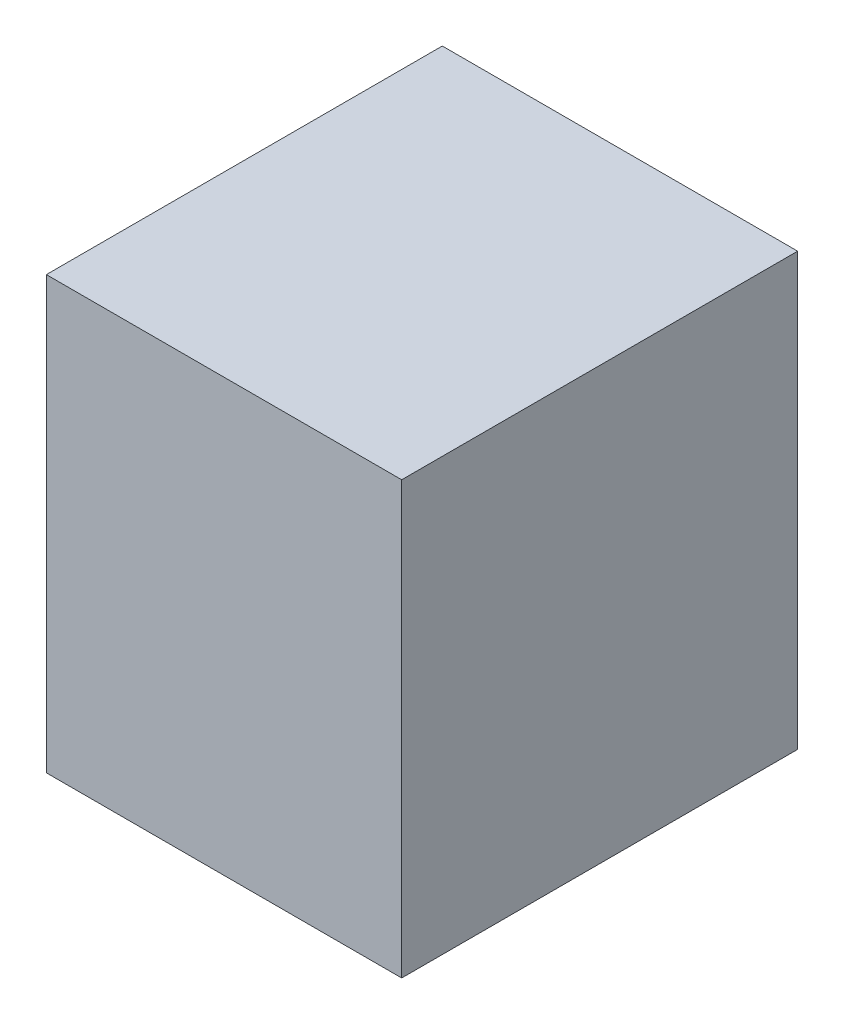
from build123d import *

# Parameters (mm, degrees)
SKETCH1_W           = 7.8
SKETCH1_H           = 8.5
BOSS_EXTRUDE1_DEPTH = 7


with BuildPart() as part:
    # Sketch1 → Boss-Extrude1 (new body)
    with BuildSketch(Plane(origin=(0, 0, 0), x_dir=(0, 0, -1), z_dir=(1, 0, 0))):
        Rectangle(SKETCH1_W, SKETCH1_H)
    extrude(amount=BOSS_EXTRUDE1_DEPTH)


solid = part.part
